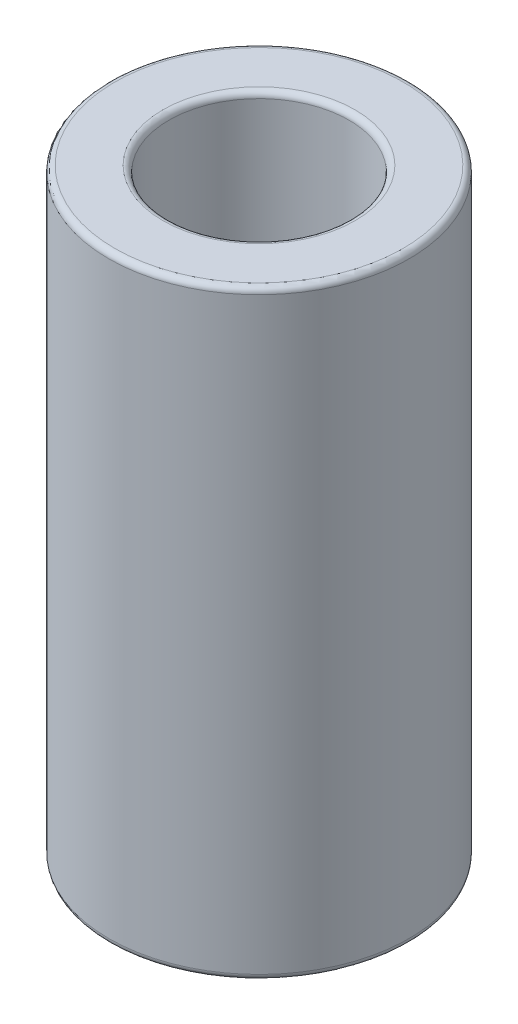
from build123d import *

# Parameters (mm, degrees)
SKETCH_1_R      = 2.5
SKETCH_1_R_2    = 1.5
EXTRUDE_1_DEPTH = 10
FILLET_1_R      = 0.1


with BuildPart() as part:
    # 草图1 → 凸台-拉伸1 (new body)
    with BuildSketch(Plane(origin=(0, 0, 0), x_dir=(1, 0, 0), z_dir=(0, 1, 0))):
        with Locations(Location((0, 0, 0), (0, 0, 270))):
            Circle(SKETCH_1_R)
        with Locations(Location((0, 0, 0), (0, 0, 270))):
            Circle(SKETCH_1_R_2, mode=Mode.SUBTRACT)
    extrude(amount=EXTRUDE_1_DEPTH)

    # 圆角1
    fillet_1_edges = [part.edges().sort_by_distance(p)[0] for p in [
        (0, 0, -2.5),
        (0, 10, -2.5),
        (0, 0, -1.5),
        (0, 10, -1.5),
    ]]
    fillet(fillet_1_edges, radius=FILLET_1_R)


solid = part.part
